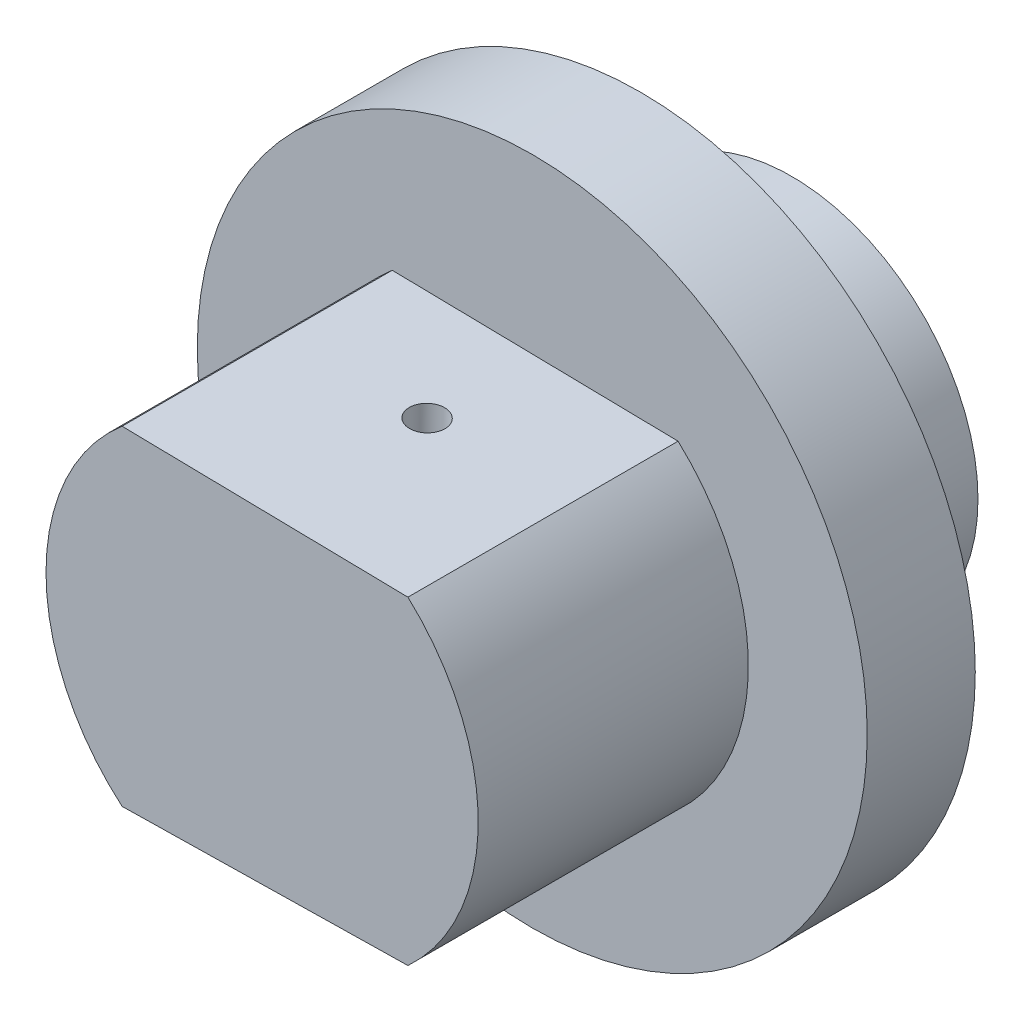
from build123d import *

# Parameters (mm, degrees)
SKETCH_1_R               = 17.25
EXTRUDE_1_DEPTH          = 14
SKETCH_2_R               = 31
EXTRUDE_2_DEPTH          = 10
CUT_EXTRUDE_1_DEPTH      = 50.979995998
CUT_EXTRUDE_1_DEPTH_BACK = 50.979995998
SKETCH_3_W               = 21
SKETCH_3_H               = 21
EXTRUDE_3_DEPTH          = 20
SKETCH_5_W               = 21
SKETCH_5_H               = 21
CUT_EXTRUDE_2_DEPTH      = 20
SKETCH_6_R               = 1.65
CUT_EXTRUDE_3_DEPTH      = 56
EXTRUDE_4_DEPTH          = 5


with BuildPart() as part:
    # 草图1 → 凸台-拉伸1 (new body)
    with BuildSketch(Plane.XY):
        Circle(SKETCH_1_R)
    extrude(amount=EXTRUDE_1_DEPTH)

    # 草图2 → 凸台-拉伸2 (add)
    with BuildSketch(Plane.XY.offset(14)):
        Circle(SKETCH_2_R)
    extrude(amount=EXTRUDE_2_DEPTH)

    # 草图3 → 切除-拉伸1 (cut, two sides: drawn at the far end of the back side and taken through both)
    with BuildSketch(Plane(origin=(0, 0, 0), x_dir=(-1, 0, 0), z_dir=(0, 0, -1)).offset(-CUT_EXTRUDE_1_DEPTH_BACK)):
        Rectangle(SKETCH_3_W, SKETCH_3_H)
    extrude(amount=CUT_EXTRUDE_1_DEPTH + CUT_EXTRUDE_1_DEPTH_BACK, mode=Mode.SUBTRACT)

    # 草图4 → 凸台-拉伸3 (add)
    with BuildSketch(Plane.XY.offset(24)):
        with BuildLine():
            Line((-12.959637187, 15.233115373), (13.493683466, 14.762130826))
            ThreePointArc((13.493683466, 14.762130826), (20, 0), (13.493683466, -14.762130826))
            Line((13.493683466, -14.762130826), (-12.959637187, -15.233115373))
            ThreePointArc((-12.959637187, -15.233115373), (-20, 0), (-12.959637187, 15.233115373))
        make_face()
    extrude(amount=EXTRUDE_3_DEPTH)

    # 草图5 → 切除-拉伸2 (cut)
    with BuildSketch(Plane(origin=(0, 0, 24), x_dir=(-1, 0, 0), z_dir=(0, 0, -1))):
        Rectangle(SKETCH_5_W, SKETCH_5_H)
    extrude(amount=-CUT_EXTRUDE_2_DEPTH, mode=Mode.SUBTRACT)

    # 草图6 → 切除-拉伸3 (cut)
    with BuildSketch(Plane(origin=(0.267023139, 14.9976231, 0), x_dir=(0.9998415399853875, -0.017801542619919335, 0), z_dir=(0.017801542619919338, 0.9998415399853876, 0))):
        with Locations((0, -34)):
            Circle(SKETCH_6_R)
    extrude(amount=-CUT_EXTRUDE_3_DEPTH, mode=Mode.SUBTRACT)

    # 草图8 → 凸台-拉伸4 (add)
    with BuildSketch(Plane.XY.offset(44)):
        with BuildLine():
            Line((-12.959637187, -15.233115373), (13.493683466, -14.762130826))
            ThreePointArc((13.493683466, -14.762130826), (20, 0), (13.493683466, 14.762130826))
            Line((13.493683466, 14.762130826), (-12.959637187, 15.233115373))
            ThreePointArc((-12.959637187, 15.233115373), (-20, 0), (-12.959637187, -15.233115373))
        make_face()
    extrude(amount=EXTRUDE_4_DEPTH)


solid = part.part
